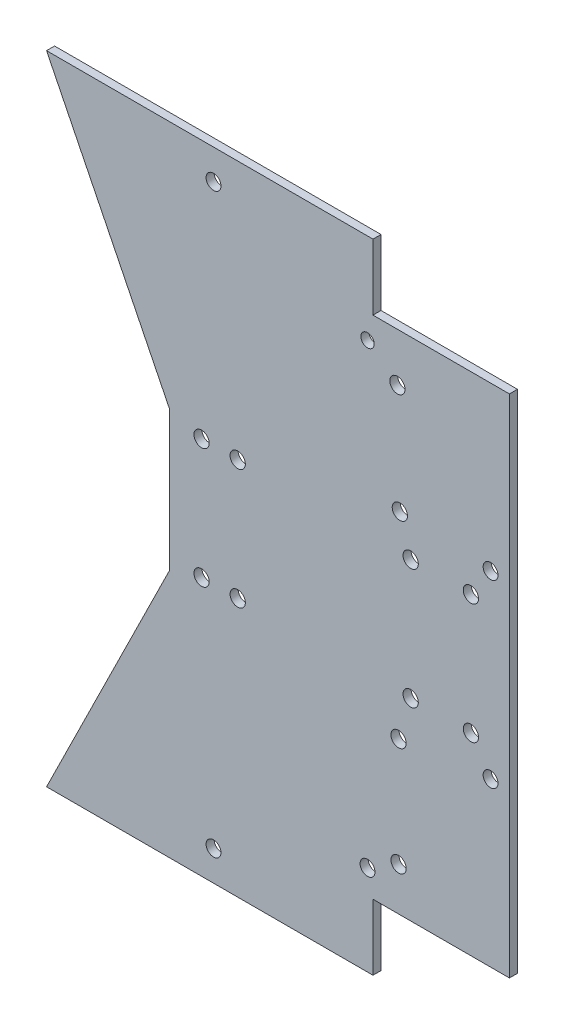
from build123d import *

# Parameters (mm, degrees)
SKETCH2_R           = 2.3495
SKETCH2_R_2         = 2.0955
BOSS_EXTRUDE1_DEPTH = 2.54
SKETCH3_W           = 31.75
SKETCH3_H           = 44.323
BOSS_EXTRUDE2_DEPTH = 2.54
SKETCH4_R           = 2.413
CUT_EXTRUDE1_DEPTH  = 238.743265275
SKETCH5_R           = 2.413
CUT_EXTRUDE2_DEPTH  = 238.743265275
SKETCH6_R           = 2.413
CUT_EXTRUDE3_DEPTH  = 238.743265275
SKETCH7_R           = 2.413
CUT_EXTRUDE4_DEPTH  = 238.743265275
SKETCH8_W           = 7.994763
SKETCH8_H           = 21.113506736
SKETCH8_W_2         = 21.493659396
SKETCH8_H_2         = 28.960940125
CUT_EXTRUDE5_DEPTH  = 238.743265275


with BuildPart() as part:
    # Sketch2 → Boss-Extrude1 (new body)
    with BuildSketch(Plane(origin=(0, 0, 0), x_dir=(-1, 0, 0), z_dir=(0, 0, 1))):
        Polygon((-2.930050059, 168.708281075), (38.709428475, 168.708281075), (38.709428475, 189.536281075), (143.497061781, 189.536281075), (104.617436481, 110.859781075), (72.867436481, 110.859781075), (72.867436481, 66.536781075), (104.617436481, 66.536781075), (143.497061781, -12.139718925), (38.709428475, -12.139718925), (38.709428475, 8.688281075), (-2.930050059, 8.688281075), align=None)
        with Locations(Location((41.95655448, 160.961281075, 0), (0, 0, 180))):
            Circle(SKETCH2_R, mode=Mode.SUBTRACT)
        with Locations(Location((90.673911143, 180.011281075, 0), (0, 0, 180))):
            Circle(SKETCH2_R, mode=Mode.SUBTRACT)
        with Locations(Location((90.673911143, -2.614718925, 0), (0, 0, 180))):
            Circle(SKETCH2_R, mode=Mode.SUBTRACT)
        with Locations(Location((3.035061781, 117.209781075, 0), (0, 0, 180))):
            Circle(SKETCH2_R, mode=Mode.SUBTRACT)
        with Locations(Location((3.035061781, 60.186781075, 0), (0, 0, 180))):
            Circle(SKETCH2_R, mode=Mode.SUBTRACT)
        with Locations(Location((41.95655448, 16.435281075, 0), (0, 0, 180))):
            Circle(SKETCH2_R_2, mode=Mode.SUBTRACT)
    extrude(amount=BOSS_EXTRUDE1_DEPTH)

    # Sketch3 → Boss-Extrude2 (add)
    with BuildSketch(Plane.XY.offset(2.54)):
        with Locations((-88.742436481, -88.698281075)):
            Rectangle(SKETCH3_W, SKETCH3_H)
    extrude(amount=-BOSS_EXTRUDE2_DEPTH)

    # Sketch4 → Cut-Extrude1 (cut, through all)
    with BuildSketch(Plane.XY.offset(2.54)):
        with Locations((-94.457436481, -69.711781075)):
            Circle(SKETCH4_R)
        with Locations((-83.027436481, -69.711781075)):
            Circle(SKETCH4_R)
        with Locations((-28.311949941, -69.711781075)):
            Circle(SKETCH4_R)
        with Locations((-9.261949941, -69.711781075)):
            Circle(SKETCH4_R)
        with Locations(Location((-9.261949941, -107.684781075, 0), (0, 0, 180))):
            Circle(SKETCH4_R)
        with Locations(Location((-28.311949941, -107.684781075, 0), (0, 0, 180))):
            Circle(SKETCH4_R)
        with Locations(Location((-83.027436481, -107.684781075, 0), (0, 0, 180))):
            Circle(SKETCH4_R)
        with Locations(Location((-94.457436481, -107.684781075, 0), (0, 0, 180))):
            Circle(SKETCH4_R)
    extrude(amount=-CUT_EXTRUDE1_DEPTH, mode=Mode.SUBTRACT)

    # Sketch5 → Cut-Extrude2 (cut, through all)
    with BuildSketch(Plane.XY.offset(2.54)):
        with Locations((-31.738991634, -58.273080522)):
            Circle(SKETCH5_R)
    extrude(amount=-CUT_EXTRUDE2_DEPTH, mode=Mode.SUBTRACT)

    # Sketch6 → Cut-Extrude3 (cut, through all)
    with BuildSketch(Plane.XY.offset(2.54)):
        with Locations((-32.511395831, -23.991781075)):
            Circle(SKETCH6_R)
    extrude(amount=-CUT_EXTRUDE3_DEPTH, mode=Mode.SUBTRACT)

    # Sketch7 → Cut-Extrude4 (cut, through all)
    with BuildSketch(Plane.XY.offset(2.54)):
        with Locations((-32.140467993, -155.071444629)):
            Circle(SKETCH7_R)
        with Locations((-32.140467993, -120.781444629)):
            Circle(SKETCH7_R)
    extrude(amount=-CUT_EXTRUDE4_DEPTH, mode=Mode.SUBTRACT)

    # Sketch8 → Cut-Extrude5 (cut, through all)
    with BuildSketch(Plane.XY.offset(2.54)):
        with Locations((-36.236046975, 1.868472293)):
            Rectangle(SKETCH8_W, SKETCH8_H)
        with Locations((-29.486598777, -183.188751137)):
            Rectangle(SKETCH8_W_2, SKETCH8_H_2)
    extrude(amount=-CUT_EXTRUDE5_DEPTH, mode=Mode.SUBTRACT)


solid = part.part
